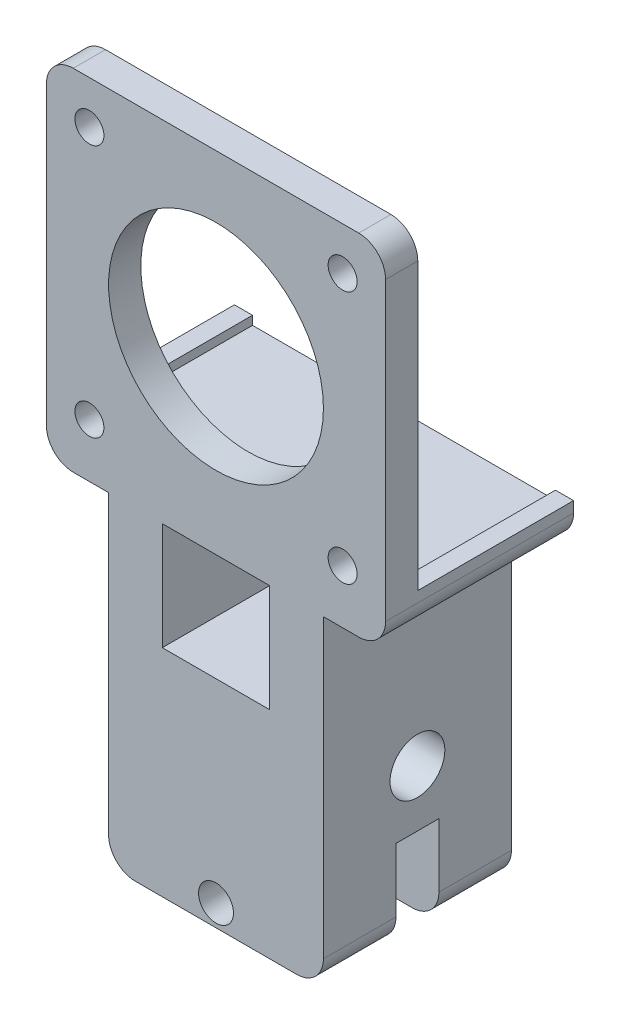
from build123d import *

# Parameters (mm, degrees)
CROQUIS1_R                   = 3.25
SALIENTE_EXTRUIR1_DEPTH      = 35
CROQUIS3_R                   = 5.1
CROQUIS3_W                   = 8
CROQUIS3_H                   = 16.86
CORTAR_EXTRUIR2_DEPTH        = 85.095950556
CROQUIS4_R                   = 11
CORTAR_EXTRUIR3_DEPTH        = 3.5
CROQUIS5_R                   = 20
CROQUIS5_R_2                 = 2.7
SALIENTE_EXTRUIR3_DEPTH      = 6
SALIENTE_EXTRUIR5_DEPTH      = 29
SALIENTE_EXTRUIR5_DEPTH_BACK = 6
CROQUIS9_W                   = 56.4
CROQUIS9_H                   = 56.4
CORTAR_EXTRUIR4_DEPTH        = 29


with BuildPart() as part:
    # Croquis1 → Saliente-Extruir1 (new body)
    # profile 1 of 2: a face of its own
    with BuildSketch(Plane.XY):
        with BuildLine():
            Line((0, 60.17), (0, 40.17))
            Line((0, 40.17), (10, 40.17))
            Line((10, 40.17), (10, 60.17))
            Line((10, 60.17), (30, 60.17))
            Line((30, 60.17), (30, 40.17))
            Line((30, 40.17), (40, 40.17))
            Line((40, 40.17), (40, 60.17))
            ThreePointArc((40, 60.17), (38.535533906, 63.705533906), (35, 65.17))
            Line((35, 65.17), (5, 65.17))
            ThreePointArc((5, 65.17), (1.464466094, 63.705533906), (0, 60.17))
        make_face()
    # profile 2 of 2: a face of its own
    with BuildSketch(Plane.XY):
        with BuildLine():
            Line((5, 0), (35, 0))
            ThreePointArc((35, 0), (38.535533906, 1.464466094), (40, 5))
            Line((40, 5), (40, 40.17))
            Line((40, 40.17), (0, 40.17))
            Line((0, 40.17), (0, 5))
            ThreePointArc((0, 5), (1.464466094, 1.464466094), (5, 0))
        make_face()
        with Locations((20, 4)):
            Circle(CROQUIS1_R, mode=Mode.SUBTRACT)
    extrude(amount=SALIENTE_EXTRUIR1_DEPTH)

    # Croquis3 → Cortar-Extruir2 (cut, through all)
    with BuildSketch(Plane.ZY):
        with Locations((17.5, 27.36)):
            Circle(CROQUIS3_R)
        with Locations((17.5, 8.43)):
            Rectangle(CROQUIS3_W, CROQUIS3_H)
    extrude(amount=-CORTAR_EXTRUIR2_DEPTH, mode=Mode.SUBTRACT)

    # Croquis4 → Cortar-Extruir3 (cut)
    with BuildSketch(Plane.ZY):
        with Locations((17.5, 27.36)):
            Circle(CROQUIS4_R)
    extrude(amount=-CORTAR_EXTRUIR3_DEPTH, mode=Mode.SUBTRACT)

    # Croquis5 → Saliente-Extruir3 (add)
    with BuildSketch(Plane.XY.offset(35)):
        with BuildLine():
            Line((-11.57, 120.31), (-11.57, 67.17))
            ThreePointArc((-11.57, 67.17), (-10.105533906, 63.634466094), (-6.57, 62.17))
            Line((-6.57, 62.17), (46.57, 62.17))
            ThreePointArc((46.57, 62.17), (50.105533906, 63.634466094), (51.57, 67.17))
            Line((51.57, 67.17), (51.57, 120.31))
            ThreePointArc((51.57, 120.31), (50.105533906, 123.845533906), (46.57, 125.31))
            Line((46.57, 125.31), (-6.57, 125.31))
            ThreePointArc((-6.57, 125.31), (-10.105533906, 123.845533906), (-11.57, 120.31))
        make_face()
        with Locations((20, 93.74)):
            Circle(CROQUIS5_R, mode=Mode.SUBTRACT)
        with Locations((-3.57, 117.31)):
            Circle(CROQUIS5_R_2, mode=Mode.SUBTRACT)
        with Locations((43.57, 117.31)):
            Circle(CROQUIS5_R_2, mode=Mode.SUBTRACT)
        with Locations((43.57, 70.17)):
            Circle(CROQUIS5_R_2, mode=Mode.SUBTRACT)
        with Locations((-3.57, 70.17)):
            Circle(CROQUIS5_R_2, mode=Mode.SUBTRACT)
    extrude(amount=-SALIENTE_EXTRUIR3_DEPTH)

    # Croquis8 → Saliente-Extruir5 (add, two sides: drawn at the far end of the back side and taken through both)
    with BuildSketch(Plane(origin=(0, 0, 29), x_dir=(-1, 0, 0), z_dir=(0, 0, -1)).offset(-SALIENTE_EXTRUIR5_DEPTH_BACK)):
        with BuildLine():
            Line((6.57, 60.17), (-46.57, 60.17))
            ThreePointArc((-46.57, 60.17), (-50.105533906, 61.634466094), (-51.57, 65.17))
            Line((-51.57, 65.17), (-51.57, 67.17))
            Line((-51.57, 67.17), (11.57, 67.17))
            Line((11.57, 67.17), (11.57, 65.17))
            ThreePointArc((11.57, 65.17), (10.105533906, 61.634466094), (6.57, 60.17))
        make_face()
    extrude(amount=SALIENTE_EXTRUIR5_DEPTH + SALIENTE_EXTRUIR5_DEPTH_BACK)

    # Croquis9 → Cortar-Extruir4 (cut)
    with BuildSketch(Plane(origin=(0, 0, 0), x_dir=(-1, 0, 0), z_dir=(0, 0, -1))):
        with Locations((-20, 93.74)):
            Rectangle(CROQUIS9_W, CROQUIS9_H)
    extrude(amount=-CORTAR_EXTRUIR4_DEPTH, mode=Mode.SUBTRACT)


solid = part.part
